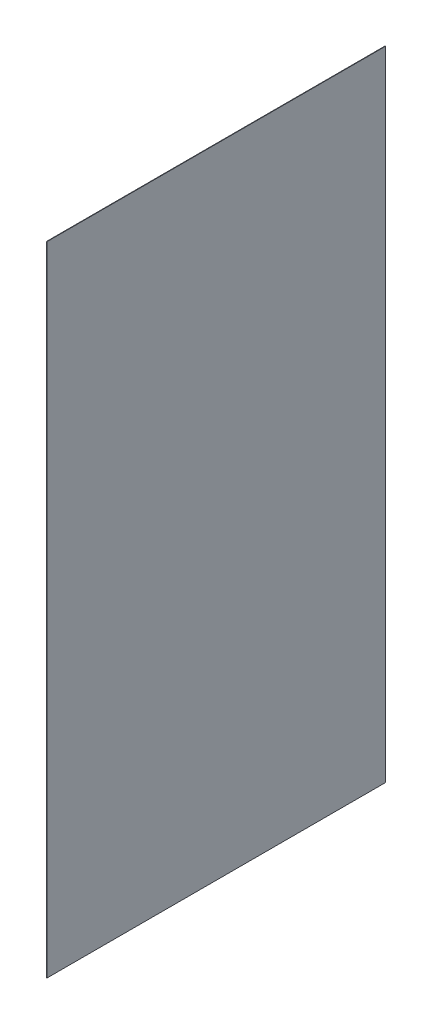
from build123d import *

# Parameters (mm, degrees)
SKETCH1_W                        = 1
SKETCH1_H                        = 1427.5
STORE_ORTA_BOLME_SAC_SOL_1_DEPTH = 757.5


with BuildPart() as part:
    # Sketch1 → STORE_orta_bolme_sac_sol_1 (new body)
    with BuildSketch(Plane.XY):
        with Locations((690.5, 896.25)):
            Rectangle(SKETCH1_W, SKETCH1_H)
    extrude(amount=-STORE_ORTA_BOLME_SAC_SOL_1_DEPTH)


solid = part.part
